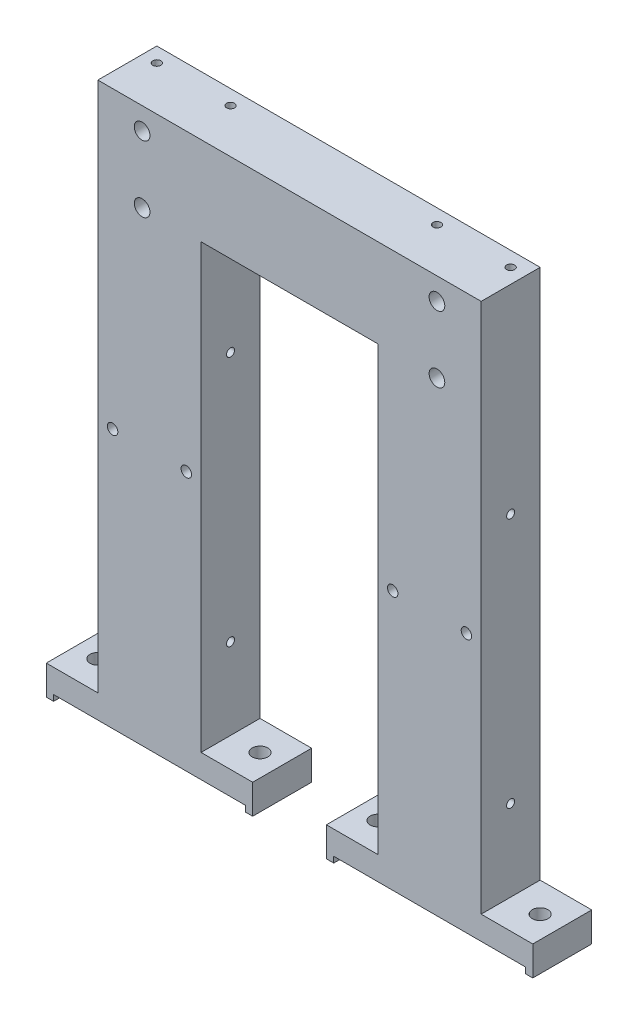
from build123d import *

# Parameters (mm, degrees)
SKETCH1_W                                        = 165.1
SKETCH1_H                                        = 241.3
BOSS_EXTRUDE1_DEPTH                              = 25.4
SKETCH2_W                                        = 76.2
SKETCH2_H                                        = 203.2
CUT_EXTRUDE1_DEPTH                               = 149.378182358
SKETCH7_W                                        = 88.9
SKETCH7_H                                        = 12.7
BOSS_EXTRUDE4_DEPTH                              = 25.4
SKETCH8_W                                        = 82.55
SKETCH8_H                                        = 25.4
CUT_EXTRUDE4_DEPTH                               = 2.54
F_1_4_CLEARANCE_HOLE1_D                          = 6.7564
F_1_4_CLEARANCE_HOLE1_DEPTH                      = 10.16
CBORE_FOR_1_4_SOCKET_HEAD_CAP_SCREW1_D           = 6.7564
CBORE_FOR_1_4_SOCKET_HEAD_CAP_SCREW1_CBORE_D     = 11.1125
CBORE_FOR_1_4_SOCKET_HEAD_CAP_SCREW1_CBORE_DEPTH = 6.35
F_8_32_TAPPED_HOLE1_D                            = 3.4544
F_8_32_TAPPED_HOLE1_DEPTH                        = 12.7
F_8_32_TAPPED_HOLE1_TIP                          = 1.037806461
CBORE_FOR_8_SOCKET_HEAD_CAP_SCREW1_D             = 4.4958
CBORE_FOR_8_SOCKET_HEAD_CAP_SCREW1_CBORE_D       = 7.9375
CBORE_FOR_8_SOCKET_HEAD_CAP_SCREW1_CBORE_DEPTH   = 4.1656
F_8_32_TAPPED_HOLE2_D                            = 3.4544
F_8_32_TAPPED_HOLE2_DEPTH                        = 44.45


with BuildPart() as part:
    # Sketch1 → Boss-Extrude1 (new body)
    with BuildSketch(Plane.XY):
        Rectangle(SKETCH1_W, SKETCH1_H)
    extrude(amount=BOSS_EXTRUDE1_DEPTH)

    # Sketch2 → Cut-Extrude1 (cut, through all)
    with BuildSketch(Plane.XY.offset(25.4)):
        with Locations((0, -19.05)):
            Rectangle(SKETCH2_W, SKETCH2_H)
    extrude(amount=-CUT_EXTRUDE1_DEPTH, mode=Mode.SUBTRACT)

    # Sketch7 → Boss-Extrude4 (add)
    with BuildSketch(Plane.XY.offset(25.4)):
        with Locations((-60.325, -114.3)):
            Rectangle(SKETCH7_W, SKETCH7_H)
    boss_extrude4 = extrude(amount=-BOSS_EXTRUDE4_DEPTH)

    # Sketch8 → Cut-Extrude4 (cut)
    with BuildSketch(Plane(origin=(0, -120.65, 0), x_dir=(-1, 0, 0), z_dir=(0, -1, 0))):
        with Locations((60.325, -12.7)):
            Rectangle(SKETCH8_W, SKETCH8_H)
    cut_extrude4 = extrude(amount=-CUT_EXTRUDE4_DEPTH, mode=Mode.SUBTRACT)

    # Mirror3: Boss-Extrude4, Cut-Extrude4 across plane
    add(boss_extrude4.mirror(Plane(origin=(0, 0, 0), x_dir=(0, 0, 1), z_dir=(1, 0, 0))))
    add(cut_extrude4.mirror(Plane(origin=(0, 0, 0), x_dir=(0, 0, 1), z_dir=(1, 0, 0))), mode=Mode.SUBTRACT)

    # 1/4 Clearance Hole1
    with Locations(Plane(origin=(0, -107.95, 0), x_dir=(1, 0, 0), z_dir=(0, 1, 0))):
        with Locations((-95.25, -12.7), (-25.4, -12.7), (25.4, -12.7), (95.25, -12.7)):
            Hole(F_1_4_CLEARANCE_HOLE1_D / 2, depth=F_1_4_CLEARANCE_HOLE1_DEPTH)

    # CBORE for 1/4 Socket Head Cap Screw1 (through all)
    with Locations(Plane(origin=(0, 0, 0), x_dir=(-1, 0, 0), z_dir=(0, 0, -1))):
        with Locations((-63.5, 111.125), (-63.5, 82.55), (63.5, 111.125), (63.5, 82.55)):
            CounterBoreHole(CBORE_FOR_1_4_SOCKET_HEAD_CAP_SCREW1_D / 2, CBORE_FOR_1_4_SOCKET_HEAD_CAP_SCREW1_CBORE_D / 2, CBORE_FOR_1_4_SOCKET_HEAD_CAP_SCREW1_CBORE_DEPTH)

    # #8-32 Tapped Hole1
    with Locations(Plane(origin=(0, 120.65, 0), x_dir=(1, 0, 0), z_dir=(0, 1, 0))):
        with Locations((-76.2, -6.35), (-44.45, -6.35), (44.45, -6.35), (76.2, -6.35)):
            Hole(F_8_32_TAPPED_HOLE1_D / 2, depth=F_8_32_TAPPED_HOLE1_DEPTH)
            with Locations((0, 0, -(F_8_32_TAPPED_HOLE1_DEPTH + F_8_32_TAPPED_HOLE1_TIP / 2))):  # 118° drill point
                Cone(0, F_8_32_TAPPED_HOLE1_D / 2, F_8_32_TAPPED_HOLE1_TIP, mode=Mode.SUBTRACT)

    # CBORE for #8 Socket Head Cap Screw1 (through all)
    with Locations(Plane(origin=(0, 0, 0), x_dir=(-1, 0, 0), z_dir=(0, 0, -1))):
        with Locations((-76.2, -6.35), (-44.45, -6.35), (44.45, -6.35), (76.2, -6.35)):
            CounterBoreHole(CBORE_FOR_8_SOCKET_HEAD_CAP_SCREW1_D / 2, CBORE_FOR_8_SOCKET_HEAD_CAP_SCREW1_CBORE_D / 2, CBORE_FOR_8_SOCKET_HEAD_CAP_SCREW1_CBORE_DEPTH)

    # #8-32 Tapped Hole2
    with Locations(Plane.ZY.offset(82.55)):
        with Locations((12.7, -73.025), (12.7, 34.925)):
            f_8_32_tapped_hole2 = Hole(F_8_32_TAPPED_HOLE2_D / 2, depth=F_8_32_TAPPED_HOLE2_DEPTH)

    # Mirror4: #8-32 Tapped Hole2 across plane
    add(f_8_32_tapped_hole2.mirror(Plane(origin=(0, 0, 0), x_dir=(0, 0, 1), z_dir=(1, 0, 0))), mode=Mode.SUBTRACT)


solid = part.part
